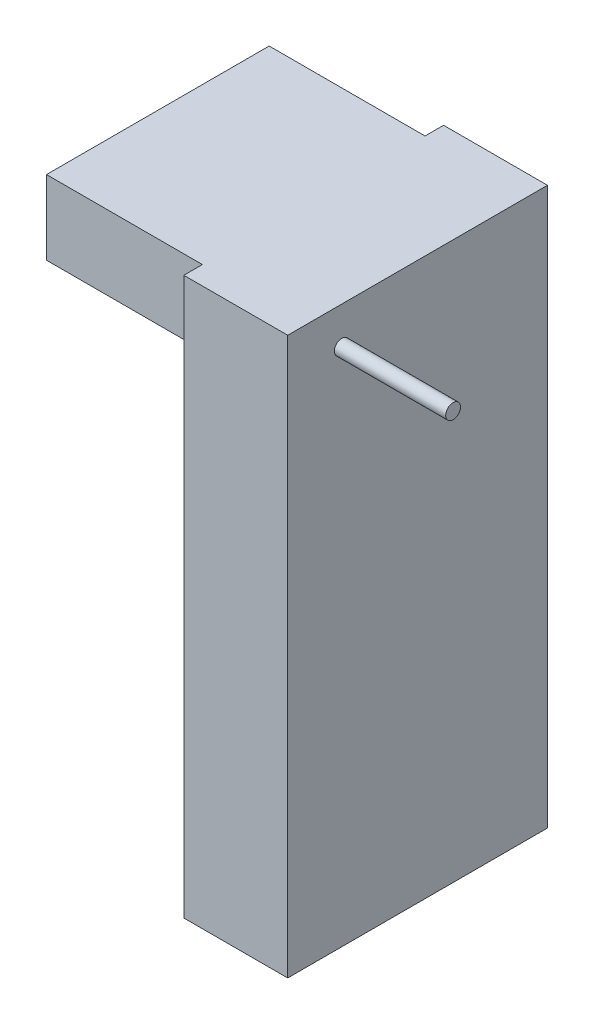
from build123d import *

# Parameters (mm, degrees)
ESQUISSE1_W        = 30
ESQUISSE1_H        = 10
BOSS_EXTRU_1_DEPTH = 35
ESQUISSE3_R        = 1
BOSS_EXTRU_2_DEPTH = 15
ESQUISSE4_W        = 35
ESQUISSE4_H        = 75
BOSS_EXTRU_3_DEPTH = 14


with BuildPart() as part:
    # Esquisse1 → Boss.-Extru.1 (new body)
    with BuildSketch(Plane(origin=(0, 0, 0), x_dir=(0, 0, -1), z_dir=(1, 0, 0))):
        with Locations((23.668323467, -1.396462247)):
            Rectangle(ESQUISSE1_W, ESQUISSE1_H)
    extrude(amount=BOSS_EXTRU_1_DEPTH)

    # Esquisse3 → Boss.-Extru.2 (add)
    with BuildSketch(Plane(origin=(35, 0, 0), x_dir=(0, 0, -1), z_dir=(1, 0, 0))):
        with Locations((13.450280626, -1.396462247)):
            Circle(ESQUISSE3_R)
    extrude(amount=BOSS_EXTRU_2_DEPTH)

    # Esquisse4 → Boss.-Extru.3 (add)
    with BuildSketch(Plane(origin=(35, 0, 0), x_dir=(0, 0, -1), z_dir=(1, 0, 0))):
        with Locations((23.668323467, -33.896462247)):
            Rectangle(ESQUISSE4_W, ESQUISSE4_H)
    extrude(amount=-BOSS_EXTRU_3_DEPTH)


solid = part.part
